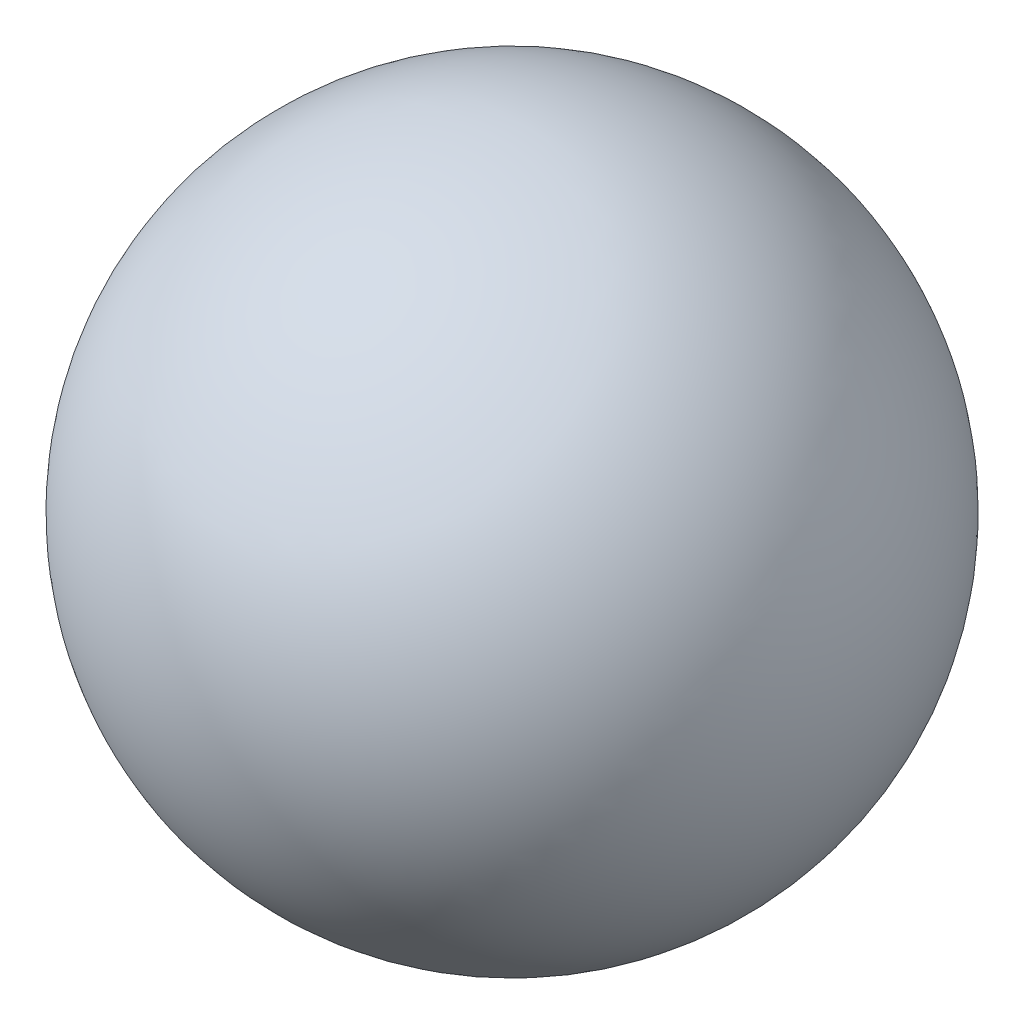
from build123d import *


with BuildPart() as part:
    # Sketch1 → Revolve6 (revolve)
    with BuildSketch(Plane(origin=(0, 0, 0), x_dir=(1, 0, 0), z_dir=(0, 1, 0))):
        with BuildLine():
            Line((0, 127), (0, -127))
            ThreePointArc((0, -127), (127, 0), (0, 127))
        make_face()
    revolve(axis=Axis((0, 0, 176.999567417), (0, 0, -1)))


solid = part.part
